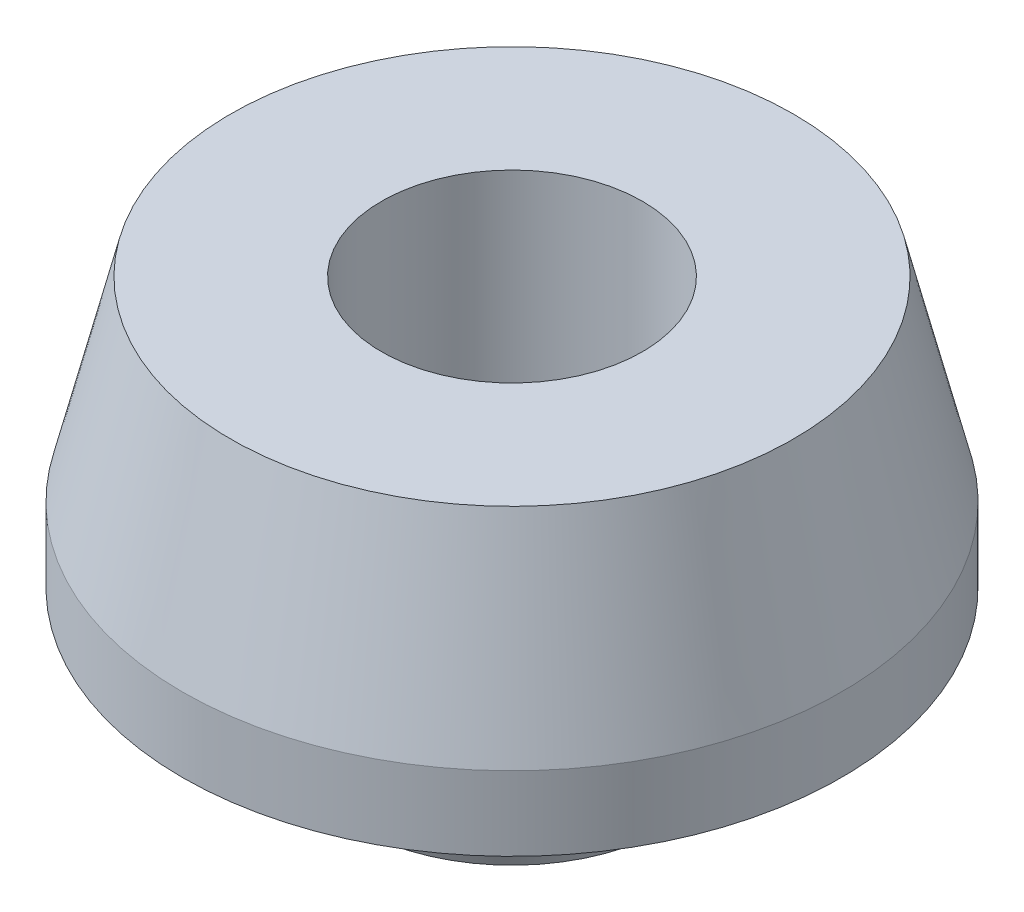
from build123d import *


with BuildPart() as part:
    # Sketch1 → Revolve1 (revolve)
    with BuildSketch(Plane.XY, mode=Mode.PRIVATE) as revolve1_sk:
        Polygon((4.75, 1.980275153), (4.75, 16.480275153), (10.25, 16.480275153), (12, 9.380275153), (12, 6.680275153), (7.25, 6.680275153), (5.75, 1.980275153), align=None)
    revolve(revolve1_sk.sketch.rotate(Axis((0, 0, 0), (0, 1, 0)), 90), axis=Axis((0, 0, 0), (0, 1, 0)))


solid = part.part
